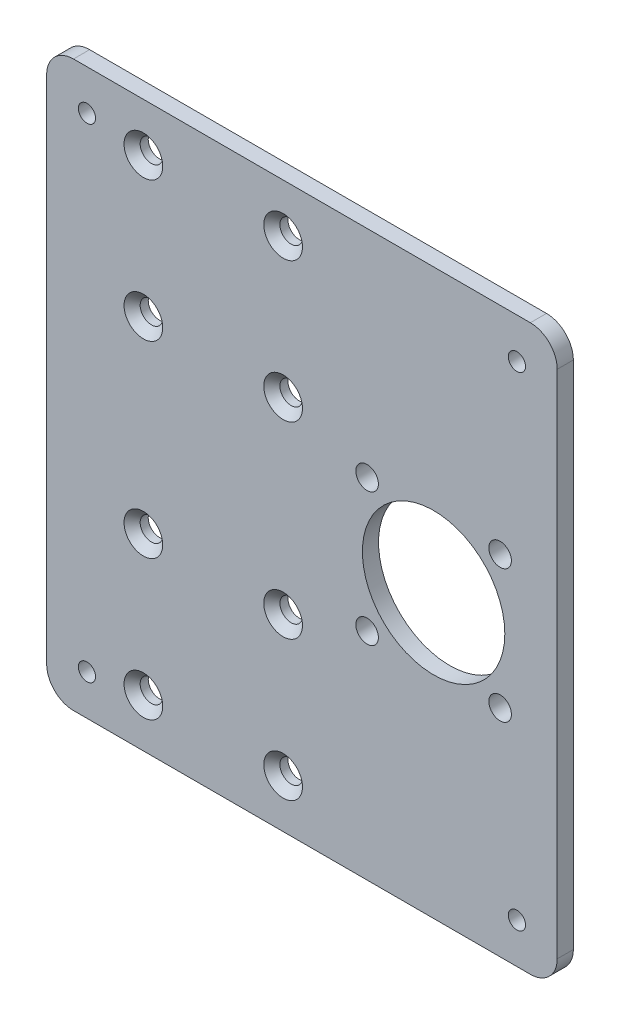
from build123d import *

# Parameters (mm, degrees)
SKETCH_2_W      = 95
SKETCH_2_H      = 105
SKETCH_2_R      = 2.1
SKETCH_2_R_2    = 13.25
SKETCH_2_R_3    = 1.6
EXTRUDE_1_DEPTH = 3
FILLET_1_R      = 5
CHAMFER_1_SIZE  = 1.5


with BuildPart() as part:
    # ｽｹｯﾁ2 → ﾎﾞｽ - 押し出し1 (new body)
    with BuildSketch(Plane.XY):
        with Locations((16.5, 0)):
            Rectangle(SKETCH_2_W, SKETCH_2_H)
        with Locations((-13, -17.5)):
            Circle(SKETCH_2_R, mode=Mode.SUBTRACT)
        with Locations((-13, -43.5)):
            Circle(SKETCH_2_R, mode=Mode.SUBTRACT)
        with Locations((13, -17.5)):
            Circle(SKETCH_2_R, mode=Mode.SUBTRACT)
        with Locations((13, -43.5)):
            Circle(SKETCH_2_R, mode=Mode.SUBTRACT)
        with Locations((41, 0)):
            Circle(SKETCH_2_R_2, mode=Mode.SUBTRACT)
        with Locations((53.374368671, 12.374368671)):
            Circle(SKETCH_2_R, mode=Mode.SUBTRACT)
        with Locations((28.625631329, -12.374368671)):
            Circle(SKETCH_2_R, mode=Mode.SUBTRACT)
        with Locations((53.374368671, -12.374368671)):
            Circle(SKETCH_2_R, mode=Mode.SUBTRACT)
        with Locations((28.625631329, 12.374368671)):
            Circle(SKETCH_2_R, mode=Mode.SUBTRACT)
        with Locations((-23.5, 45)):
            Circle(SKETCH_2_R_3, mode=Mode.SUBTRACT)
        with Locations((-23.5, -45)):
            Circle(SKETCH_2_R_3, mode=Mode.SUBTRACT)
        with Locations((56.5, -45)):
            Circle(SKETCH_2_R_3, mode=Mode.SUBTRACT)
        with Locations((56.5, 45)):
            Circle(SKETCH_2_R_3, mode=Mode.SUBTRACT)
        with Locations((-13, 17.5)):
            Circle(SKETCH_2_R, mode=Mode.SUBTRACT)
        with Locations((13, 17.5)):
            Circle(SKETCH_2_R, mode=Mode.SUBTRACT)
        with Locations((13, 43.5)):
            Circle(SKETCH_2_R, mode=Mode.SUBTRACT)
        with Locations((-13, 43.5)):
            Circle(SKETCH_2_R, mode=Mode.SUBTRACT)
    extrude(amount=EXTRUDE_1_DEPTH)

    # ﾌｨﾚｯﾄ1
    fillet_1_edges = [part.edges().sort_by_distance(p)[0] for p in [
        (64, -52.5, 1.5),
        (-31, -52.5, 1.5),
        (-31, 52.5, 1.5),
        (64, 52.5, 1.5),
    ]]
    fillet(fillet_1_edges, radius=FILLET_1_R)

    # 面取り1
    chamfer_1_edges = [part.edges().sort_by_distance(p)[0] for p in [
        (-15.1, -17.5, 3),
        (-15.1, -43.5, 3),
        (10.9, -17.5, 3),
        (10.9, -43.5, 3),
        (-15.1, 17.5, 3),
        (10.9, 17.5, 3),
        (10.9, 43.5, 3),
        (-15.1, 43.5, 3),
    ]]
    chamfer(chamfer_1_edges, length=CHAMFER_1_SIZE)


solid = part.part
